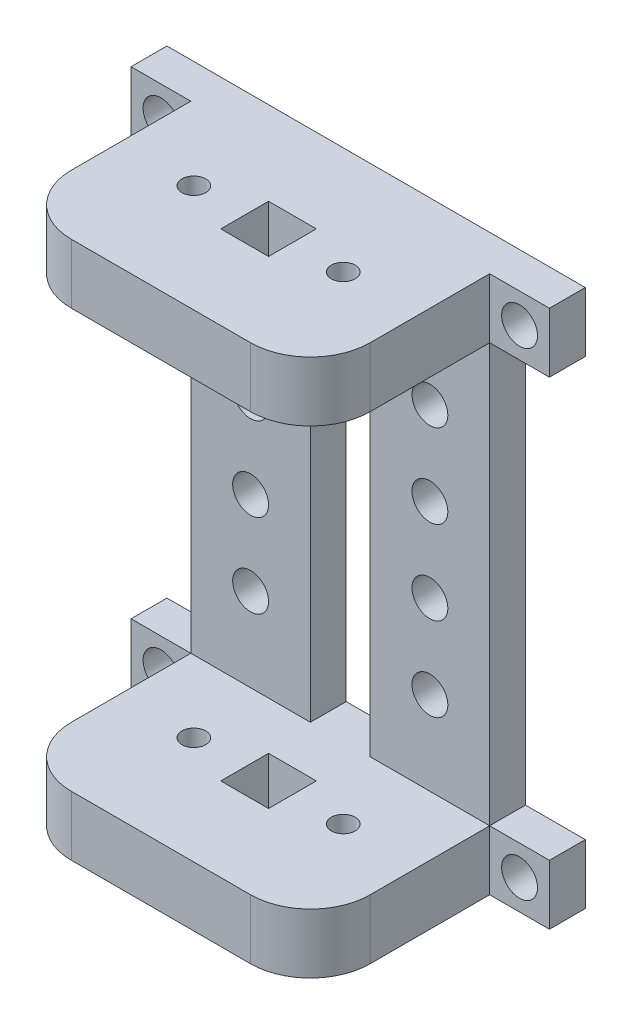
from build123d import *

# Parameters (mm, degrees)
ESBO_O1_R                = 1.5
ESBO_O1_W                = 5
ESBO_O1_H                = 35
RESSALTO_EXTRUS_O1_DEPTH = 3
ESBO_O2_W                = 25
ESBO_O2_H                = 5
RESSALTO_EXTRUS_O2_DEPTH = 15
FILETE5_R                = 5
FILETE6_R                = 5
FILETE7_R                = 5
FILETE8_R                = 5
ESBO_O3_R                = 1
ESBO_O3_W                = 4
ESBO_O3_H                = 4
CORTE_EXTRUS_O1_DEPTH    = 5
CORTE_EXTRUS_O2_START    = -5
ESBO_O4_R                = 1
ESBO_O4_W                = 4
ESBO_O4_H                = 4
CORTE_EXTRUS_O2_DEPTH    = 5


with BuildPart() as part:
    # Esboço1 → Ressalto-extrusão1 (new body)
    with BuildSketch(Plane.XY):
        Polygon((-24.430369357, 7.066666667), (10.569630643, 7.066666667), (10.569630643, 2.066666667), (5.569630643, 2.066666667), (5.569630643, -32.933333333), (10.569630643, -32.933333333), (10.569630643, -37.933333333), (-24.430369357, -37.933333333), (-24.430369357, -32.933333333), (-19.430369357, -32.933333333), (-19.430369357, 2.066666667), (-24.430369357, 2.066666667), align=None)
        with Locations((-14.430369357, -4.933333333)):
            Circle(ESBO_O1_R, mode=Mode.SUBTRACT)
        with Locations((-14.430369357, -11.933333333)):
            Circle(ESBO_O1_R, mode=Mode.SUBTRACT)
        with Locations((-14.430369357, -18.933333333)):
            Circle(ESBO_O1_R, mode=Mode.SUBTRACT)
        with Locations((0.569630643, -4.933333333)):
            Circle(ESBO_O1_R, mode=Mode.SUBTRACT)
        with Locations((0.569630643, -18.933333333)):
            Circle(ESBO_O1_R, mode=Mode.SUBTRACT)
        with Locations((0.569630643, -25.933333333)):
            Circle(ESBO_O1_R, mode=Mode.SUBTRACT)
        with Locations((-14.430369357, -25.933333333)):
            Circle(ESBO_O1_R, mode=Mode.SUBTRACT)
        with Locations((0.569630643, -11.933333333)):
            Circle(ESBO_O1_R, mode=Mode.SUBTRACT)
        with Locations((-21.930369357, 4.566666667)):
            Circle(ESBO_O1_R, mode=Mode.SUBTRACT)
        with Locations((8.069630643, 4.566666667)):
            Circle(ESBO_O1_R, mode=Mode.SUBTRACT)
        with Locations((-21.930369357, -35.433333333)):
            Circle(ESBO_O1_R, mode=Mode.SUBTRACT)
        with Locations((8.069630643, -35.433333333)):
            Circle(ESBO_O1_R, mode=Mode.SUBTRACT)
        with Locations((-6.930369357, -15.433333333)):
            Rectangle(ESBO_O1_W, ESBO_O1_H, mode=Mode.SUBTRACT)
    extrude(amount=-RESSALTO_EXTRUS_O1_DEPTH)

    # Esboço2 → Ressalto-extrusão2 (add)
    with BuildSketch(Plane.XY):
        with Locations((-6.930369357, 4.566666667)):
            Rectangle(ESBO_O2_W, ESBO_O2_H)
        with Locations((-6.930369357, -35.433333333)):
            Rectangle(ESBO_O2_W, ESBO_O2_H)
    extrude(amount=RESSALTO_EXTRUS_O2_DEPTH)

    # Filete5
    filete5_edges = [part.edges().sort_by_distance(p)[0] for p in [
        (5.569630643, -35.433333333, 15),
    ]]
    fillet(filete5_edges, radius=FILETE5_R)

    # Filete6
    filete6_edges = [part.edges().sort_by_distance(p)[0] for p in [
        (-19.430369357, -35.433333333, 15),
    ]]
    fillet(filete6_edges, radius=FILETE6_R)

    # Filete7
    filete7_edges = [part.edges().sort_by_distance(p)[0] for p in [
        (-19.430369357, 4.566666667, 15),
    ]]
    fillet(filete7_edges, radius=FILETE7_R)

    # Filete8
    filete8_edges = [part.edges().sort_by_distance(p)[0] for p in [
        (5.569630643, 4.566666667, 15),
    ]]
    fillet(filete8_edges, radius=FILETE8_R)

    # Esboço3 → Corte-extrusão1 (cut)
    with BuildSketch(Plane(origin=(0, -37.933333333, 0), x_dir=(-1, 0, 0), z_dir=(0, -1, 0))):
        with Locations(Location((13.180369357, -6, 0), (0, 0, 180))):
            Circle(ESBO_O3_R)
        with Locations(Location((0.680369357, -6.000000354, 0), (0, 0, 180))):
            Circle(ESBO_O3_R)
        with Locations((6.930369357, -6)):
            Rectangle(ESBO_O3_W, ESBO_O3_H)
    extrude(amount=-CORTE_EXTRUS_O1_DEPTH, mode=Mode.SUBTRACT)

    # Esboço4 → Corte-extrusão2 (cut)
    with BuildSketch(Plane(origin=(0, 7.066666667, 0), x_dir=(1, 0, 0), z_dir=(0, 1, 0)).offset(CORTE_EXTRUS_O2_START)):
        with Locations((-13.180369357, -6)):
            Circle(ESBO_O4_R)
        with Locations(Location((-0.680369357, -6, 0), (0, 0, 359.999979706))):
            Circle(ESBO_O4_R)
        with Locations((-6.930369357, -6)):
            Rectangle(ESBO_O4_W, ESBO_O4_H)
    extrude(amount=CORTE_EXTRUS_O2_DEPTH, mode=Mode.SUBTRACT)


solid = part.part
